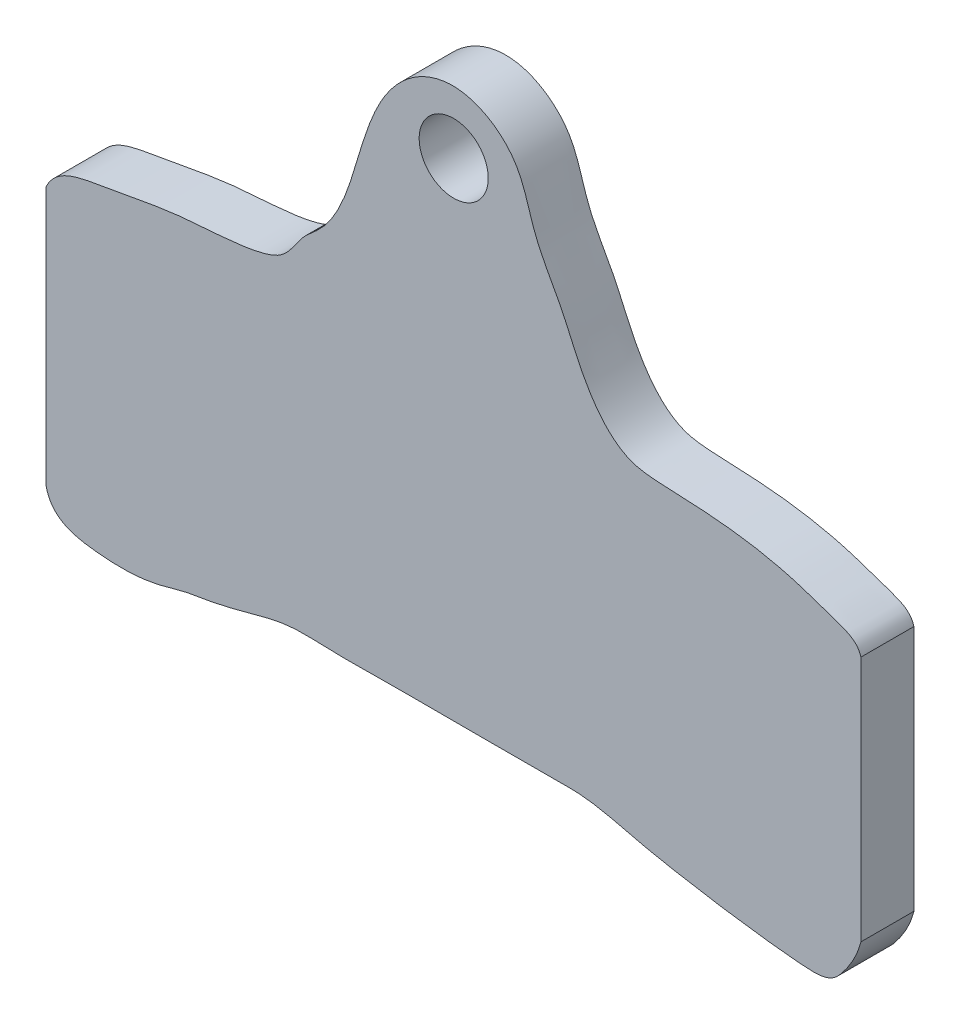
from build123d import *

# Parameters (mm, degrees)
SKETCH1_R      = 2.475066367
EXTRUDE1_DEPTH = 3.8


with BuildPart() as part:
    # Sketch1 → Extrude1 (new body)
    with BuildSketch(Plane.XY):
        with BuildLine():
            Line((1.744252399, 33.734555812), (1.744252399, 15.187549075))
            add(Edge.make_bspline(
                [(1.744252399, 15.187549075), (2.136324611, 13.36392355), (4.68795818, 12.88960045), (7.779573315, 12.722242733), (9.815636026, 13.024536892), (11.620950864, 13.611193239), (13.601094645, 13.870874014), (16.169139592, 14.509987394), (18.99769208, 15.345980766), (22.363573014, 15.126647638), (26.684498744, 15.218463471), (31.843059372, 15.174999451), (36.03954004, 15.196929825), (38.511354643, 15.181210133), (40.870280077, 15.240115559), (43.655475544, 14.402705521), (46.802111293, 13.806719409), (49.884880557, 13.264724773), (52.926794805, 12.842146476), (55.850945269, 12.523267373), (57.893201158, 12.454678568), (59.257328635, 14.025339517), (59.866251814, 15.141269717), (60.105948171, 16.071267101)],
                knots=[0, 0, 0, 0, 0.074492953, 0.112517437, 0.153165101, 0.173137192, 0.204804801, 0.249876438, 0.302183518, 0.346612335, 0.412538965, 0.512862099, 0.597420168, 0.616702395, 0.633180456, 0.711962313, 0.755809423, 0.789267525, 0.864423935, 0.903513372, 0.936327344, 0.954797396, 1, 1, 1, 1], degree=3))
            Line((60.105948171, 16.071267101), (60.105948171, 33.734555812))
            add(Edge.make_bspline(
                [(1.744252399, 33.734555812), (2.421268943, 35.201591323), (4.795329726, 35.615288458), (7.897835761, 36.158651314), (10.450074989, 36.637440065), (13.571601636, 36.902734108), (16.264461937, 37.0497758), (19.042477286, 37.897565571), (19.870386283, 39.706534549), (22.676018055, 41.851334177), (24.071514018, 46.824124592), (25.701724301, 51.884629608), (28.676541613, 54.207816137), (31.012333917, 54.804827204), (33.563923185, 54.006501577), (35.92247157, 51.760889045), (36.560820243, 48.152994232), (38.802475143, 44.677393091), (40.222577169, 40.743414328), (42.862970977, 37.481629443), (46.567427228, 37.292671945), (50.518538556, 37.134638936), (54.390010271, 36.479402974), (57.226012285, 35.478242519), (58.861137062, 34.949455101), (59.914122349, 34.464286868), (60.105948171, 33.734555812)],
                knots=[0, 0, 0, 0, 0.054730258, 0.08497818, 0.121850139, 0.1533153, 0.204191975, 0.22595419, 0.258939662, 0.273958635, 0.359356146, 0.444753657, 0.470010793, 0.500150505, 0.532762545, 0.567774438, 0.618621012, 0.667418949, 0.723451096, 0.781320261, 0.809895448, 0.860500565, 0.933915278, 0.957807108, 0.974936546, 1, 1, 1, 1], degree=3))
        make_face()
        with Locations(Location((30.940335645, 50.095809478, 0), (0, 0, 180))):
            Circle(SKETCH1_R, mode=Mode.SUBTRACT)
    extrude(amount=EXTRUDE1_DEPTH)


solid = part.part
